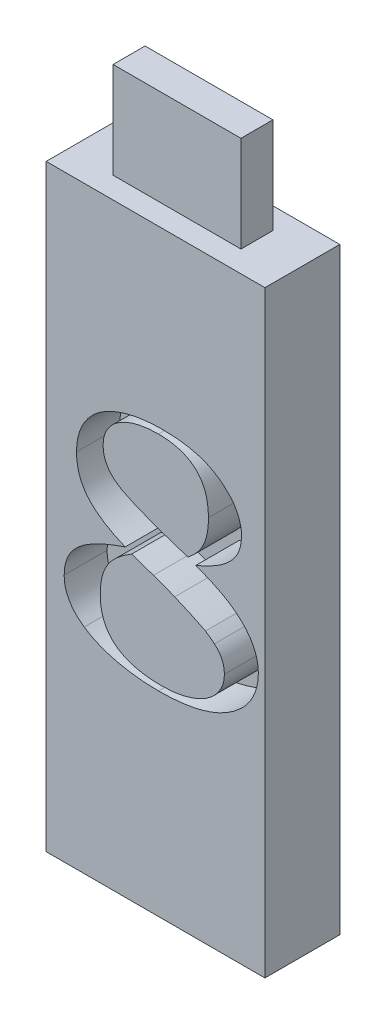
from build123d import *

# Parameters (mm, degrees)
SKETCH1_W           = 17.38
SKETCH1_H           = 47.498
BOSS_EXTRUDE1_DEPTH = 5.95
CUT_EXTRUDE1_DEPTH  = 3.41
SKETCH3_W           = 10.16
SKETCH3_H           = 2.54
BOSS_EXTRUDE2_DEPTH = 7.62


with BuildPart() as part:
    # Sketch1 → Boss-Extrude1 (new body)
    with BuildSketch(Plane.XY):
        Rectangle(SKETCH1_W, SKETCH1_H)
    extrude(amount=BOSS_EXTRUDE1_DEPTH)

    # Sketch2 → Cut-Extrude1 (cut)
    with BuildSketch(Plane.XY.offset(5.95)):
        with BuildLine():
            add(Edge.make_bspline(
                [(-2.416400219, 0.356371676), (-2.582450006, 0.428417664), (-2.906210243, 0.568891353), (-3.368449159, 0.796228293), (-3.794881537, 1.030724181), (-4.183175277, 1.273084986), (-4.534916687, 1.520685114), (-4.855692766, 1.768775092), (-5.134307638, 2.030768082), (-5.381062722, 2.297225955), (-5.593097902, 2.57752234), (-5.774276594, 2.872321199), (-5.934264765, 3.180090692), (-6.061359793, 3.506700785), (-6.156181822, 3.849841833), (-6.229169028, 4.207400776), (-6.269330377, 4.58098219), (-6.27554935, 4.835569446), (-6.278711608, 4.96502343)],
                knots=[0, 0, 0, 0, 1.348003904, 2.628308472, 3.835031645, 4.971269036, 6.035377854, 7.038106289, 7.988583642, 8.880402946, 9.740173826, 10.601440914, 11.45499964, 12.320392761, 13.206127786, 14.103703299, 15.035760215, 16, 16, 16, 16], degree=3))
            add(Edge.make_bspline(
                [(-6.278711608, 4.96502343), (-6.277370369, 5.089560586), (-6.274733697, 5.334381581), (-6.229793108, 5.694363147), (-6.168435057, 6.042868875), (-6.077978669, 6.379702681), (-5.963384058, 6.704862471), (-5.819040433, 7.015271151), (-5.655881818, 7.317102472), (-5.460598752, 7.602234089), (-5.244147991, 7.877034566), (-5.000214595, 8.133639497), (-4.735741323, 8.376951119), (-4.447263912, 8.601320503), (-4.135596999, 8.806586266), (-3.802598653, 8.996766085), (-3.447283287, 9.173793889), (-2.932781782, 9.38305171), (-2.241853685, 9.602007535), (-1.355236382, 9.793009742), (-0.401635351, 9.904202801), (0.256446614, 9.917574389), (0.595083154, 9.924455156)],
                knots=[0, 0, 0, 0, 0.783782621, 1.540796714, 2.28145939, 3.011185787, 3.734746204, 4.449902516, 5.165187549, 5.893103365, 6.623544335, 7.36619315, 8.120323523, 8.885081382, 9.665135515, 10.468753104, 11.299115158, 12.16330645, 13.964531475, 15.856105703, 17.867630331, 20, 20, 20, 20], degree=3))
            add(Edge.make_bspline(
                [(0.595083154, 9.924455156), (0.870112268, 9.919191731), (1.403817712, 9.908977837), (2.176969363, 9.837628627), (2.893124821, 9.703408644), (3.556921664, 9.534477731), (4.161236589, 9.300258191), (4.710633525, 9.020395855), (5.207100735, 8.689298457), (5.491936447, 8.4221579), (5.632880617, 8.289969756)],
                knots=[0, 0, 0, 0, 1.214433109, 2.356657988, 3.423177516, 4.429025061, 5.376606453, 6.27811622, 7.147966809, 8, 8, 8, 8], degree=3))
            add(Edge.make_bspline(
                [(5.632880617, 8.289969756), (5.722864473, 8.20707991), (5.903092494, 8.041060427), (6.14312409, 7.761680837), (6.344124758, 7.450257603), (6.51915863, 7.122868665), (6.654666495, 6.781506162), (6.758571952, 6.438937671), (6.820450152, 6.094259891), (6.827336727, 5.86335724), (6.830756903, 5.748680813)],
                knots=[0, 0, 0, 0, 1.014380047, 2.031694559, 3.044761832, 4.083257027, 5.106415224, 6.08581988, 7.049333839, 8, 8, 8, 8], degree=3))
            add(Edge.make_bspline(
                [(6.830756903, 5.748680813), (6.826536769, 5.615302127), (6.818199164, 5.351789492), (6.749672942, 4.966785107), (6.63720915, 4.600545377), (6.477935858, 4.253193177), (6.271404898, 3.918628918), (5.999662017, 3.606297334), (5.681782974, 3.298105857), (5.303862201, 3.003052218), (4.867445614, 2.715447062), (4.369241488, 2.433082664), (3.807807882, 2.151996215), (3.40603934, 1.979989846), (3.196079326, 1.890101126)],
                knots=[0, 0, 0, 0, 0.84751596, 1.674414184, 2.477368164, 3.277161434, 4.097834299, 4.967637948, 5.901653103, 6.909486553, 8.010557461, 9.221971674, 10.548231611, 12, 12, 12, 12], degree=3))
            add(Edge.make_bspline(
                [(3.196079326, 1.890101126), (3.365656267, 1.827720526), (3.695453014, 1.706401444), (4.16954877, 1.512018927), (4.611444456, 1.314225091), (5.021220695, 1.112014405), (5.4026871, 0.912505792), (5.75039858, 0.707338452), (6.064881354, 0.498261403), (6.259198872, 0.35228023), (6.35309907, 0.281737639)],
                knots=[0, 0, 0, 0, 1.219042085, 2.370818287, 3.456481827, 4.484937262, 5.453572937, 6.360386886, 7.207688542, 8, 8, 8, 8], degree=3))
            add(Edge.make_bspline(
                [(6.35309907, 0.281737639), (6.497108913, 0.163606785), (6.777186887, -0.066140359), (7.150196239, -0.444081992), (7.459235714, -0.842918999), (7.723189424, -1.250309795), (7.920522663, -1.679625544), (8.065530569, -2.123639005), (8.147580683, -2.584922969), (8.160309013, -2.897370494), (8.166706157, -3.054403792)],
                knots=[0, 0, 0, 0, 1.134353331, 2.206150456, 3.226419909, 4.204059172, 5.156796381, 6.096269919, 7.043202493, 8, 8, 8, 8], degree=3))
            add(Edge.make_bspline(
                [(8.166706157, -3.054403792), (8.162176901, -3.195195882), (8.15319257, -3.4744742), (8.087654159, -3.889984906), (7.978664848, -4.29714298), (7.829210348, -4.695457272), (7.643538905, -5.080043238), (7.419177364, -5.443197881), (7.155577827, -5.782854717), (6.954743198, -5.988154307), (6.853147114, -6.092009078)],
                knots=[0, 0, 0, 0, 0.993949225, 1.971619778, 2.962342455, 3.965716872, 4.971395428, 5.973230809, 6.97471958, 8, 8, 8, 8], degree=3))
            add(Edge.make_bspline(
                [(6.853147114, -6.092009078), (6.663222843, -6.263875166), (6.280167999, -6.610508785), (5.619209557, -7.042691323), (4.894314822, -7.413724463), (4.095233361, -7.709977095), (3.231511106, -7.946358025), (2.295275644, -8.105845218), (1.291500478, -8.209091608), (0.59784453, -8.220609922), (0.24057148, -8.226542522)],
                knots=[0, 0, 0, 0, 0.861834979, 1.738219453, 2.650973175, 3.600571314, 4.60399876, 5.663669963, 6.796654509, 8, 8, 8, 8], degree=3))
            add(Edge.make_bspline(
                [(0.24057148, -8.226542522), (-0.054373875, -8.222622616), (-0.635196265, -8.214903325), (-1.491407847, -8.142549046), (-2.318506483, -8.022473036), (-3.110653219, -7.861614268), (-3.853023881, -7.657144272), (-4.527220585, -7.405298231), (-5.133487705, -7.125156128), (-5.491219389, -6.891047307), (-5.662980807, -6.778642214)],
                knots=[0, 0, 0, 0, 1.148278009, 2.261251341, 3.34282844, 4.40102023, 5.406977439, 6.33724529, 7.201644358, 8, 8, 8, 8], degree=3))
            add(Edge.make_bspline(
                [(-5.662980807, -6.778642214), (-5.78936138, -6.687880985), (-6.035237841, -6.511302818), (-6.362674823, -6.210193009), (-6.639642971, -5.889675), (-6.867816044, -5.549360793), (-7.044120793, -5.190478723), (-7.16827785, -4.811127275), (-7.244917101, -4.413337404), (-7.255020328, -4.14067298), (-7.260149188, -4.002256056)],
                knots=[0, 0, 0, 0, 1.115953349, 2.17111424, 3.183996681, 4.149667166, 5.103921479, 6.044039155, 7.007064869, 8, 8, 8, 8], degree=3))
            add(Edge.make_bspline(
                [(-7.260149188, -4.002256056), (-7.254659803, -3.842599685), (-7.243890444, -3.529377614), (-7.15192697, -3.074381456), (-7.002449367, -2.647801247), (-6.788385064, -2.24779509), (-6.506845175, -1.869544434), (-6.152390296, -1.511552996), (-5.725280434, -1.170963764), (-5.223433623, -0.845203618), (-4.639636122, -0.533397447), (-3.975357052, -0.225253066), (-3.226926407, 0.077716786), (-2.694732497, 0.260682417), (-2.416400219, 0.356371676)],
                knots=[0, 0, 0, 0, 0.819352103, 1.607447054, 2.373268099, 3.133526076, 3.928299588, 4.78667385, 5.7135892, 6.728933894, 7.855253168, 9.109998917, 10.488557333, 12, 12, 12, 12], degree=3))
        make_face()
        with BuildLine():
            add(Edge.make_bspline(
                [(2.565421717, 2.151320254), (2.704975366, 2.263944118), (2.97542, 2.482200824), (3.325796418, 2.851535857), (3.613324802, 3.241923317), (3.838306618, 3.660376821), (4.001772598, 4.112667356), (4.121254075, 4.600335908), (4.192665056, 5.1295959), (4.199900253, 5.495943211), (4.203638818, 5.685241882)],
                knots=[0, 0, 0, 0, 1.059223662, 2.052696998, 2.999889951, 3.917771738, 4.850728594, 5.83520782, 6.881410429, 8, 8, 8, 8], degree=3))
            add(Edge.make_bspline(
                [(4.203638818, 5.685241882), (4.201272824, 5.835899594), (4.19666449, 6.129341212), (4.146633907, 6.554836881), (4.06930455, 6.951988069), (3.962337245, 7.320568288), (3.819330284, 7.65982591), (3.643728648, 7.970185011), (3.437688005, 8.252728181), (3.199264931, 8.503981812), (2.934558113, 8.731584967), (2.632106233, 8.919160127), (2.306106661, 9.085562668), (1.948712704, 9.221307313), (1.559688567, 9.318104108), (1.142373824, 9.394337068), (0.695547063, 9.438586617), (0.387447281, 9.444013205), (0.229376375, 9.446797322)],
                knots=[0, 0, 0, 0, 1.153746292, 2.247194472, 3.276995721, 4.250957685, 5.181964778, 6.0909582, 6.977288973, 7.853727812, 8.739597368, 9.643732105, 10.572835046, 11.540998452, 12.564962581, 13.639813917, 14.789104127, 16, 16, 16, 16], degree=3))
            add(Edge.make_bspline(
                [(0.229376375, 9.446797322), (0.015197193, 9.443157546), (-0.400732169, 9.436089214), (-1.003510667, 9.362696741), (-1.56658594, 9.24987437), (-2.084287374, 9.086424495), (-2.553604326, 8.881234775), (-2.969491945, 8.639966555), (-3.331368148, 8.361525579), (-3.630896353, 8.043846821), (-3.86978489, 7.692626951), (-4.045703986, 7.310429011), (-4.148149869, 6.893400848), (-4.160339793, 6.605043611), (-4.166568375, 6.45770416)],
                knots=[0, 0, 0, 0, 1.298533817, 2.52171261, 3.677383028, 4.777431251, 5.807817739, 6.778343902, 7.686916665, 8.567618685, 9.415150478, 10.2525124, 11.107101088, 12, 12, 12, 12], degree=3))
            add(Edge.make_bspline(
                [(-4.166568375, 6.45770416), (-4.163120953, 6.369283755), (-4.156341546, 6.195403729), (-4.119843464, 5.938250498), (-4.051121263, 5.690896843), (-3.928092383, 5.376091627), (-3.717605476, 5.008961751), (-3.484135511, 4.770296471), (-3.367984185, 4.651560477)],
                knots=[0, 0, 0, 0, 0.783537966, 1.540838934, 2.294604849, 3.051665315, 4.533203267, 6, 6, 6, 6], degree=3))
            add(Edge.make_bspline(
                [(-3.367984185, 4.651560477), (-3.327398006, 4.616154821), (-3.236545509, 4.536898966), (-3.074888851, 4.420224809), (-2.880485058, 4.284467725), (-2.736493365, 4.193194971), (-2.658960838, 4.144049028)],
                knots=[0, 0, 0, 0, 0.740090135, 1.656697916, 2.738245725, 4, 4, 4, 4], degree=3))
            add(Edge.make_bspline(
                [(-2.658960838, 4.144049028), (-2.543674565, 4.084776897), (-2.302664852, 3.960866572), (-1.918285417, 3.783973283), (-1.49947169, 3.599977429), (-1.045632047, 3.415712448), (-0.558650894, 3.223613159), (-0.036821744, 3.031049966), (0.52011776, 2.832168037), (0.904593971, 2.702974573), (1.102594602, 2.636441491)],
                knots=[0, 0, 0, 0, 0.766899967, 1.60322939, 2.502958476, 3.473331371, 4.501092627, 5.600238108, 6.764151449, 8, 8, 8, 8], degree=3))
            add(Edge.make_bspline(
                [(1.102594602, 2.636441491), (1.192145397, 2.607803069), (1.393725173, 2.543337683), (1.728189956, 2.437180065), (2.124825784, 2.299823431), (2.411101512, 2.20333399), (2.565421717, 2.151320254)],
                knots=[0, 0, 0, 0, 0.732038927, 1.647827271, 2.732034396, 4, 4, 4, 4], degree=3))
        make_face(mode=Mode.SUBTRACT)
        with BuildLine():
            add(Edge.make_bspline(
                [(-1.893961964, 0.132469566), (-2.034366013, 0.045807953), (-2.307574998, -0.122824873), (-2.687006253, -0.395458994), (-3.030648532, -0.672214507), (-3.334082299, -0.959206193), (-3.598393731, -1.258898833), (-3.821109787, -1.575554354), (-4.003979127, -1.908847475), (-4.152466184, -2.259692227), (-4.259248096, -2.633701903), (-4.337310896, -3.031870219), (-4.387196871, -3.457410292), (-4.39182568, -3.750845622), (-4.394202187, -3.901500106)],
                knots=[0, 0, 0, 0, 1.182676298, 2.3013424, 3.347402352, 4.344128671, 5.292184535, 6.207673676, 7.113774727, 8.013179491, 8.933218696, 9.896959722, 10.920264822, 12, 12, 12, 12], degree=3))
            add(Edge.make_bspline(
                [(-4.394202187, -3.901500106), (-4.390715458, -4.057138826), (-4.383941069, -4.359530373), (-4.328978639, -4.797631178), (-4.230603293, -5.204980323), (-4.096899639, -5.583373506), (-3.925862872, -5.932965492), (-3.712699344, -6.249521595), (-3.467233026, -6.540556745), (-3.174299702, -6.793799957), (-2.849881216, -7.023661212), (-2.483828915, -7.217186844), (-2.080746411, -7.381041642), (-1.641843073, -7.519121852), (-1.163245832, -7.622511953), (-0.646977783, -7.695982183), (-0.092344893, -7.740861549), (0.290241157, -7.746161092), (0.486863801, -7.748884688)],
                knots=[0, 0, 0, 0, 1.05185866, 2.043663483, 2.977686967, 3.879242498, 4.751625577, 5.600473565, 6.453185544, 7.316935792, 8.210338341, 9.135731053, 10.10849934, 11.148291552, 12.241770788, 13.414217255, 14.671087357, 16, 16, 16, 16], degree=3))
            add(Edge.make_bspline(
                [(0.486863801, -7.748884688), (0.719748093, -7.744549626), (1.17336875, -7.736105632), (1.834999741, -7.650613792), (2.459892395, -7.518132497), (3.045359657, -7.332830012), (3.582149376, -7.099141845), (4.061997022, -6.824580496), (4.480506382, -6.50776996), (4.831064248, -6.150426178), (5.113343514, -5.762364443), (5.320265588, -5.350010813), (5.444787434, -4.912486961), (5.460672816, -4.612549938), (5.468685737, -4.46125538)],
                knots=[0, 0, 0, 0, 1.269665602, 2.473101726, 3.632208739, 4.750154165, 5.816593397, 6.819750063, 7.758816024, 8.670420287, 9.540397343, 10.365732835, 11.175641187, 12, 12, 12, 12], degree=3))
            add(Edge.make_bspline(
                [(5.468685737, -4.46125538), (5.466964012, -4.376520081), (5.46360377, -4.211144699), (5.424533982, -3.968281458), (5.361479501, -3.738240358), (5.275210677, -3.518537617), (5.1623315, -3.311704796), (5.022605279, -3.118090039), (4.862028189, -2.932221138), (4.737422574, -2.82286824), (4.673833248, -2.767062752)],
                knots=[0, 0, 0, 0, 1.048930303, 2.047166289, 3.037880026, 3.999398613, 4.964860898, 5.9483571, 6.9529959, 8, 8, 8, 8], degree=3))
            add(Edge.make_bspline(
                [(4.673833248, -2.767062752), (4.563080841, -2.675912247), (4.334479108, -2.487770395), (4.090557148, -2.319946418), (3.964809902, -2.233429391)],
                knots=[0, 0, 0, 0, 0.968955104, 2, 2, 2, 2], degree=3))
            add(Edge.make_bspline(
                [(3.964809902, -2.233429391), (3.786241464, -2.14150473), (3.415700374, -1.950755096), (2.82704687, -1.67600555), (2.189932372, -1.392638839), (1.746050564, -1.206378765), (1.516813504, -1.110187141)],
                knots=[0, 0, 0, 0, 0.894452839, 1.856047647, 2.892783339, 4, 4, 4, 4], degree=3))
            add(Edge.make_bspline(
                [(1.516813504, -1.110187141), (1.37045426, -1.0494041), (1.086666415, -0.931546916), (0.662499807, -0.776127347), (0.247821759, -0.622216737), (-0.029197389, -0.525120253), (-0.169915721, -0.475797831)],
                knots=[0, 0, 0, 0, 1.055018375, 2.045660952, 3.007247941, 4, 4, 4, 4], degree=3))
            add(Edge.make_bspline(
                [(-0.169915721, -0.475797831), (-0.263038568, -0.440500317), (-0.46101247, -0.3654598), (-0.762527735, -0.2620451), (-1.052707378, -0.156294028), (-1.323170929, -0.062040394), (-1.596663583, 0.036620061), (-1.788002423, 0.09830803), (-1.893961964, 0.132469566)],
                knots=[0, 0, 0, 0, 0.980390502, 2.08425469, 3.137861331, 4.020952681, 4.904044032, 6, 6, 6, 6], degree=3))
        make_face(mode=Mode.SUBTRACT)
    extrude(amount=-CUT_EXTRUDE1_DEPTH, mode=Mode.SUBTRACT)

    # Sketch3 → Boss-Extrude2 (add)
    with BuildSketch(Plane(origin=(0, 23.749, 0), x_dir=(1, 0, 0), z_dir=(0, 1, 0))):
        with Locations((0, -2.975)):
            Rectangle(SKETCH3_W, SKETCH3_H)
    extrude(amount=BOSS_EXTRUDE2_DEPTH)


solid = part.part
